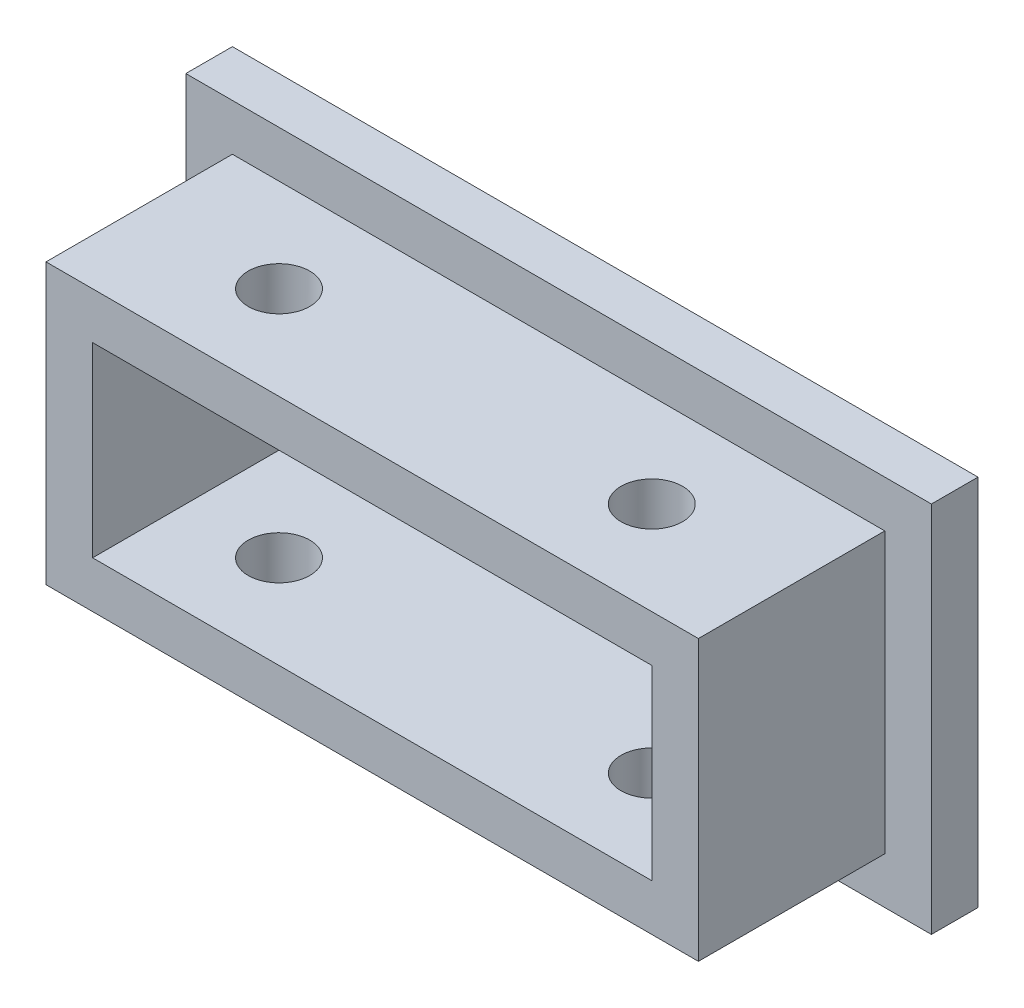
from build123d import *

# Parameters (mm, degrees)
SKETCH1_W           = 44.45
SKETCH1_H           = 19.05
SKETCH1_W_2         = 38.1
SKETCH1_H_2         = 12.7
BOSS_EXTRUDE1_DEPTH = 12.7
CUT_EXTRUDE1_REACH  = 33.908
SKETCH2_R           = 2.0955
SKETCH3_W           = 50.8
SKETCH3_H           = 25.4
BOSS_EXTRUDE2_DEPTH = 3.175


with BuildPart() as part:
    # Sketch1 → Boss-Extrude1 (new body)
    with BuildSketch(Plane.XY):
        Rectangle(SKETCH1_W, SKETCH1_H)
        Rectangle(SKETCH1_W_2, SKETCH1_H_2, mode=Mode.SUBTRACT)
    extrude(amount=BOSS_EXTRUDE1_DEPTH)

    # Cut-Extrude1: up to this face of the body (flat: up to its plane)
    cut_extrude1_end = Plane(part.part.faces().sort_by_distance((0, -9.525, 6.35))[0])
    # Sketch2 → Cut-Extrude1 (cut, up to the picked face)
    with BuildSketch(Plane(origin=(0, 9.525, 0), x_dir=(1, 0, 0), z_dir=(0, 1, 0)), mode=Mode.PRIVATE) as cut_extrude1_sk1:
        with Locations(Location((-12.7, -6.35, 0), (0, 0, 270))):
            Circle(SKETCH2_R)
    cut_extrude1_tool1 = split(extrude(cut_extrude1_sk1.sketch, amount=-CUT_EXTRUDE1_REACH, mode=Mode.PRIVATE), bisect_by=cut_extrude1_end, keep=Keep.BOTH, mode=Mode.PRIVATE)
    # Sketch2 → Cut-Extrude1 (cut, up to the picked face)
    with BuildSketch(Plane(origin=(0, 9.525, 0), x_dir=(1, 0, 0), z_dir=(0, 1, 0)), mode=Mode.PRIVATE) as cut_extrude1_sk2:
        with Locations(Location((12.7, -6.35, 0), (0, 0, 90))):
            Circle(SKETCH2_R)
    cut_extrude1_tool2 = split(extrude(cut_extrude1_sk2.sketch, amount=-CUT_EXTRUDE1_REACH, mode=Mode.PRIVATE), bisect_by=cut_extrude1_end, keep=Keep.BOTH, mode=Mode.PRIVATE)
    add(cut_extrude1_tool1.solids().sort_by(Axis((-12.7, 9.525, 6.35), (0, -1, 0)))[0], mode=Mode.SUBTRACT)
    add(cut_extrude1_tool2.solids().sort_by(Axis((12.7, 9.525, 6.35), (0, -1, 0)))[0], mode=Mode.SUBTRACT)

    # Sketch3 → Boss-Extrude2 (add)
    with BuildSketch(Plane(origin=(0, 0, 0), x_dir=(-1, 0, 0), z_dir=(0, 0, -1))):
        Rectangle(SKETCH3_W, SKETCH3_H)
    extrude(amount=BOSS_EXTRUDE2_DEPTH)


solid = part.part
